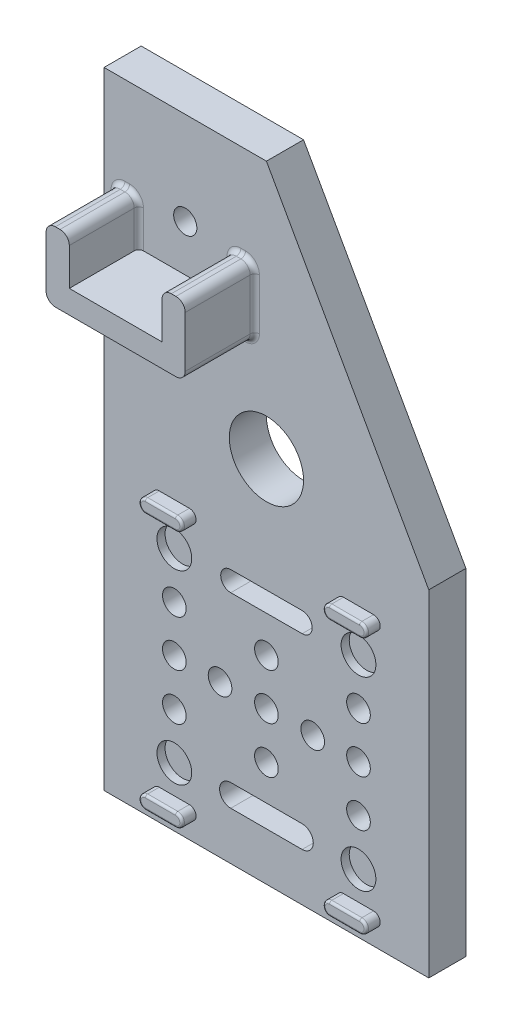
from build123d import *

# Parameters (mm, degrees)
ESQUISSE1_R             = 2.5
BOSS_EXTRU_1_DEPTH      = 8
BOSS_EXTRU_3_DEPTH      = 15
CONG_1_R                = 1
ESQUISSE5_R             = 3.75
ENL_V_MAT_EXTRU_1_DEPTH = 1.75
ESQUISSE6_R             = 2.55
ENL_V_MAT_EXTRU_2_DEPTH = 153.807067899
ENL_V_MAT_EXTRU_3_DEPTH = 153.807067899
BOSS_EXTRU_4_DEPTH      = 3
CONG_2_R                = 0.5
ESQUISSE10_R            = 12
ENL_V_MAT_EXTRU_4_DEPTH = 153.807067899
ESQUISSE11_R            = 2.5
ENL_V_MAT_EXTRU_5_DEPTH = 153.807067899
ESQUISSE12_R            = 12
ESQUISSE12_R_2          = 8
ESQUISSE12_R_3          = 2.5
BOSS_EXTRU_5_DEPTH      = 8


with BuildPart() as part:
    # Esquisse1 → Boss.-Extru.1 (new body)
    with BuildSketch(Plane.XY):
        Polygon((0, 0), (70, 0), (70, 72.472327189), (35, 135), (0, 135), align=None)
        with Locations((17.5, 115)):
            Circle(ESQUISSE1_R, mode=Mode.SUBTRACT)
    extrude(amount=BOSS_EXTRU_1_DEPTH)

    # Esquisse4 → Boss.-Extru.3 (add)
    with BuildSketch(Plane(origin=(0, 0, 0), x_dir=(-1, 0, 0), z_dir=(0, 0, -1))):
        with BuildLine():
            Line((-27.49686293, 105), (-7.50313707, 105))
            Line((-7.50313707, 105), (-7.50313707, 113))
            ThreePointArc((-7.50313707, 113), (-6.917350632, 114.414213562), (-5.50313707, 115))
            Line((-5.50313707, 115), (-4.504414059, 115))
            ThreePointArc((-4.504414059, 115), (-3.090200496, 114.414213562), (-2.504414059, 113))
            Line((-2.504414059, 113), (-2.504414059, 102.004411464))
            ThreePointArc((-2.504414059, 102.004411464), (-3.090200496, 100.590197902), (-4.504414059, 100.004411464))
            Line((-4.504414059, 100.004411464), (-30.495585941, 100.004411464))
            ThreePointArc((-30.495585941, 100.004411464), (-31.909799504, 100.590197902), (-32.495585941, 102.004411464))
            Line((-32.495585941, 102.004411464), (-32.495585941, 113))
            ThreePointArc((-32.495585941, 113), (-31.909799504, 114.414213562), (-30.495585941, 115))
            Line((-30.495585941, 115), (-29.49686293, 115))
            ThreePointArc((-29.49686293, 115), (-28.082649368, 114.414213562), (-27.49686293, 113))
            Line((-27.49686293, 113), (-27.49686293, 105))
        make_face()
    extrude(amount=BOSS_EXTRU_3_DEPTH)

    # Congé1
    cong_1_edges = [part.edges().sort_by_distance(p)[0] for p in [
        (7.50313707, 109, 0),
        (27.49686293, 109, 0),
        (28.082649368, 114.414213562, 0),
        (29.996224436, 115, 0),
        (31.909799504, 114.414213562, 0),
        (32.495585941, 107.502205732, 0),
        (31.909799504, 100.590197902, 0),
        (17.5, 100.004411464, 0),
        (3.090200496, 100.590197902, 0),
        (2.504414059, 107.502205732, 0),
        (3.090200496, 114.414213562, 0),
        (5.003775564, 115, 0),
        (6.917350632, 114.414213562, 0),
    ]]
    fillet(cong_1_edges, radius=CONG_1_R)

    # Esquisse5 → Enlèv. mat.-Extru.1 (cut)
    with BuildSketch(Plane(origin=(0, 0, 0), x_dir=(-1, 0, 0), z_dir=(0, 0, -1))):
        with Locations((-54.85, 52.748281044)):
            Circle(ESQUISSE5_R)
        with Locations((-15.15, 52.748281044)):
            Circle(ESQUISSE5_R)
        with Locations((-54.85, 12.75)):
            Circle(ESQUISSE5_R)
        with Locations((-15.15, 12.75)):
            Circle(ESQUISSE5_R)
    extrude(amount=-ENL_V_MAT_EXTRU_1_DEPTH, mode=Mode.SUBTRACT)

    # Esquisse6 → Enlèv. mat.-Extru.2 (cut, through all)
    with BuildSketch(Plane(origin=(0, 0, 0), x_dir=(-1, 0, 0), z_dir=(0, 0, -1))):
        with Locations((-54.846908299, 42.752516513)):
            Circle(ESQUISSE6_R)
        with Locations((-34.997746817, 42.752516513)):
            Circle(ESQUISSE6_R)
        with Locations((-54.846908299, 32.788691402)):
            Circle(ESQUISSE6_R)
        with Locations((-44.984599054, 32.788691402)):
            Circle(ESQUISSE6_R)
        with Locations((-34.997746817, 32.788691402)):
            Circle(ESQUISSE6_R)
        with Locations((-25.000410905, 32.788691402)):
            Circle(ESQUISSE6_R)
        with Locations((-15.150407315, 42.752516513)):
            Circle(ESQUISSE6_R)
        with Locations((-15.15, 32.788691402)):
            Circle(ESQUISSE6_R)
        with Locations((-15.15, 22.746834884)):
            Circle(ESQUISSE6_R)
        with Locations((-34.997746817, 22.746834884)):
            Circle(ESQUISSE6_R)
        with Locations((-54.846908299, 22.746834884)):
            Circle(ESQUISSE6_R)
    extrude(amount=-ENL_V_MAT_EXTRU_2_DEPTH, mode=Mode.SUBTRACT)

    # Esquisse7 → Enlèv. mat.-Extru.3 (cut, through all)
    with BuildSketch(Plane(origin=(0, 0, 0), x_dir=(-1, 0, 0), z_dir=(0, 0, -1))):
        with BuildLine():
            Line((-42.688697109, 54.953454119), (-27.29882218, 54.909006883))
            ThreePointArc((-27.29882218, 54.909006883), (-25.144336695, 52.742040688), (-27.311302891, 50.587555204))
            Line((-27.311302891, 50.587555204), (-42.70117782, 50.63200244))
            ThreePointArc((-42.70117782, 50.63200244), (-44.855663305, 52.798968635), (-42.688697109, 54.953454119))
        make_face()
        with BuildLine():
            Line((-42.694937465, 15.15279537), (-27.305062535, 15.15279537))
            ThreePointArc((-27.305062535, 15.15279537), (-24.902267165, 12.75), (-27.305062535, 10.34720463))
            Line((-27.305062535, 10.34720463), (-42.694937465, 10.34720463))
            ThreePointArc((-42.694937465, 10.34720463), (-45.097732835, 12.75), (-42.694937465, 15.15279537))
        make_face()
    extrude(amount=-ENL_V_MAT_EXTRU_3_DEPTH, mode=Mode.SUBTRACT)

    # Esquisse8 → Boss.-Extru.4 (add)
    with BuildSketch(Plane(origin=(0, 0, 0), x_dir=(-1, 0, 0), z_dir=(0, 0, -1))):
        with BuildLine():
            Line((-58.096218294, 61.887268694), (-51.603781706, 61.887268694))
            ThreePointArc((-51.603781706, 61.887268694), (-50.166286551, 60.449773539), (-51.603781706, 59.012278383))
            Line((-51.603781706, 59.012278383), (-58.096218294, 59.012278383))
            ThreePointArc((-58.096218294, 59.012278383), (-59.533713449, 60.449773539), (-58.096218294, 61.887268694))
        make_face()
        with BuildLine():
            Line((-11.903781706, 61.887268694), (-18.396218294, 61.887268694))
            ThreePointArc((-18.396218294, 61.887268694), (-19.833713449, 60.449773539), (-18.396218294, 59.012278383))
            Line((-18.396218294, 59.012278383), (-11.903781706, 59.012278383))
            ThreePointArc((-11.903781706, 59.012278383), (-10.466286551, 60.449773539), (-11.903781706, 61.887268694))
        make_face()
        with BuildLine():
            Line((-58.096218294, 3.690114109), (-51.603781706, 3.690114109))
            ThreePointArc((-51.603781706, 3.690114109), (-50.166286551, 5.127609265), (-51.603781706, 6.56510442))
            Line((-51.603781706, 6.56510442), (-58.096218294, 6.56510442))
            ThreePointArc((-58.096218294, 6.56510442), (-59.533713449, 5.127609265), (-58.096218294, 3.690114109))
        make_face()
        with BuildLine():
            Line((-11.903781706, 3.690114109), (-18.396218294, 3.690114109))
            ThreePointArc((-18.396218294, 3.690114109), (-19.833713449, 5.127609265), (-18.396218294, 6.56510442))
            Line((-18.396218294, 6.56510442), (-11.903781706, 6.56510442))
            ThreePointArc((-11.903781706, 6.56510442), (-10.466286551, 5.127609265), (-11.903781706, 3.690114109))
        make_face()
    extrude(amount=BOSS_EXTRU_4_DEPTH)

    # Congé2
    cong_2_edges = [part.edges().sort_by_distance(p)[0] for p in [
        (59.533713449, 60.449773539, -3),
        (54.85, 59.012278383, -3),
        (50.166286551, 60.449773539, -3),
        (54.85, 61.887268694, -3),
        (10.466286551, 60.449773539, -3),
        (15.15, 61.887268694, -3),
        (19.833713449, 60.449773539, -3),
        (15.15, 59.012278383, -3),
        (59.533713449, 5.127609265, -3),
        (54.85, 3.690114109, -3),
        (50.166286551, 5.127609265, -3),
        (54.85, 6.56510442, -3),
        (10.466286551, 5.127609265, -3),
        (15.15, 6.56510442, -3),
        (19.833713449, 5.127609265, -3),
        (15.15, 3.690114109, -3),
    ]]
    fillet(cong_2_edges, radius=CONG_2_R)

    # Esquisse10 → Enlèv. mat.-Extru.4 (cut, through all)
    with BuildSketch(Plane(origin=(0, 0, 0), x_dir=(-1, 0, 0), z_dir=(0, 0, -1))):
        with Locations((-35, 79.405545715)):
            Circle(ESQUISSE10_R)
    extrude(amount=-ENL_V_MAT_EXTRU_4_DEPTH, mode=Mode.SUBTRACT)

    # Esquisse11 → Enlèv. mat.-Extru.5 (cut, through all)
    with BuildSketch(Plane(origin=(0, 0, 0), x_dir=(-1, 0, 0), z_dir=(0, 0, -1))):
        with Locations((-61, 71.814130875)):
            Circle(ESQUISSE11_R)
        with Locations((-9, 79.404327963)):
            Circle(ESQUISSE11_R)
        with Locations((-41, 105.405545715)):
            Circle(ESQUISSE11_R)
    extrude(amount=-ENL_V_MAT_EXTRU_5_DEPTH, mode=Mode.SUBTRACT)


with BuildPart() as body_2:
    # Symétrie1: mirrored copy
    add(part.part.mirror(Plane(origin=(0, 0, 8), x_dir=(1, 0, 0), z_dir=(0, 0, -1))))

    # Esquisse12 → Boss.-Extru.5 (add)
    # profile 1 of 4: a face of its own
    with BuildSketch(Plane(origin=(0, 0, 8), x_dir=(-1, 0, 0), z_dir=(0, 0, -1))):
        with Locations((-35, 79.405545715)):
            Circle(ESQUISSE12_R)
        with Locations((-35, 79.405545715)):
            Circle(ESQUISSE12_R_2, mode=Mode.SUBTRACT)
    # profile 2 of 4: a face of its own
    with BuildSketch(Plane(origin=(0, 0, 8), x_dir=(-1, 0, 0), z_dir=(0, 0, -1))):
        with Locations((-41, 105.405545715)):
            Circle(ESQUISSE12_R_3)
    # profile 3 of 4: a face of its own
    with BuildSketch(Plane(origin=(0, 0, 8), x_dir=(-1, 0, 0), z_dir=(0, 0, -1))):
        with Locations((-9, 79.404327963)):
            Circle(ESQUISSE12_R_3)
    # profile 4 of 4: a face of its own
    with BuildSketch(Plane(origin=(0, 0, 8), x_dir=(-1, 0, 0), z_dir=(0, 0, -1))):
        with Locations((-61, 71.814130875)):
            Circle(ESQUISSE12_R_3)
    extrude(amount=-BOSS_EXTRU_5_DEPTH)


solid = body_2.part
